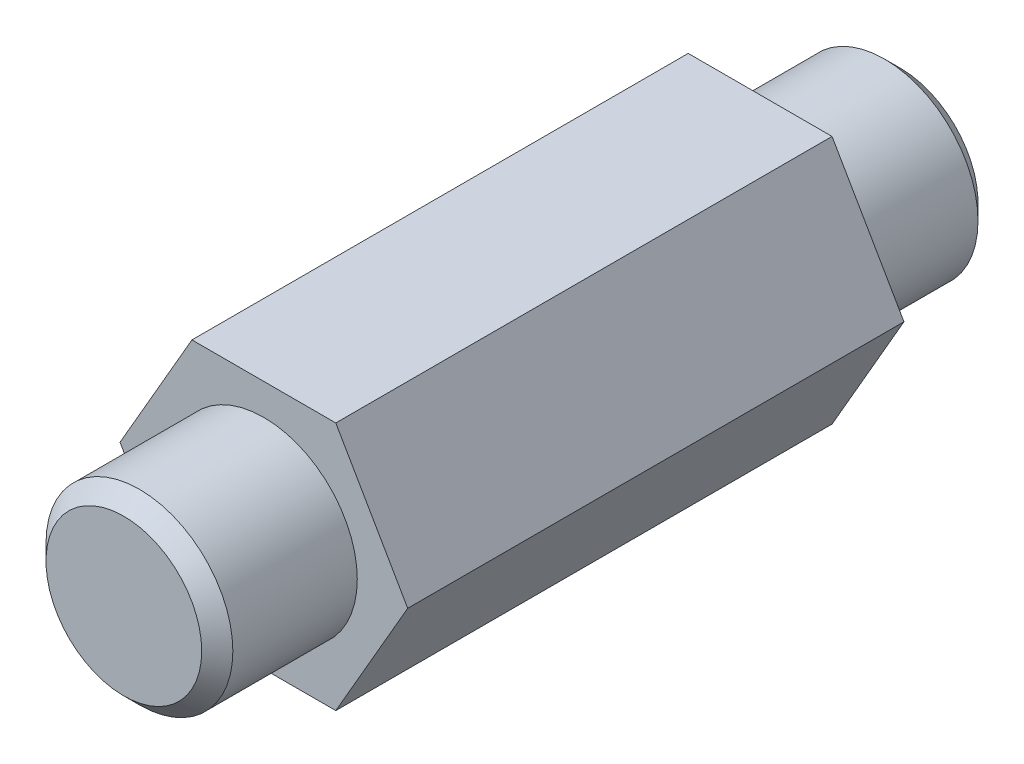
from build123d import *

# Parameters (mm, degrees)
EXTRUSI_N_HEX_PROFILE_DEPTH = 19.7866


with BuildPart() as part:
    # Croquis2 → Extrusión Hex Profile (new, symmetric)
    with BuildSketch(Plane.XY):
        Polygon((3.666174209, -6.35), (7.332348419, 0), (3.666174209, 6.35), (-3.666174209, 6.35), (-7.332348419, 0), (-3.666174209, -6.35), align=None)
    extrude(amount=EXTRUSI_N_HEX_PROFILE_DEPTH, both=True)

    # Croquis10 → Round End 1 (revolve, cut)
    with BuildSketch(Plane(origin=(0, 0, 0), x_dir=(1, 0, 0), z_dir=(0, 1, 0))):
        Polygon((-3.96875, -19.7866), (-4.7625, -18.99285), (-4.7625, -12.6492), (-9.525, -12.6492), (-9.525, -19.7866), align=None)
    revolve(axis=Axis((0, 0, 19.7866), (0, 0, -1)), mode=Mode.SUBTRACT)

    # Croquis12 → Round End 2 (revolve, cut)
    with BuildSketch(Plane.XZ):
        Polygon((-3.96875, -19.7866), (-4.7625, -18.99285), (-4.7625, -12.6492), (-9.525, -12.6492), (-9.525, -19.7866), align=None)
    revolve(axis=Axis((0, 0, -19.7866), (0, 0, 1)), mode=Mode.SUBTRACT)


solid = part.part
